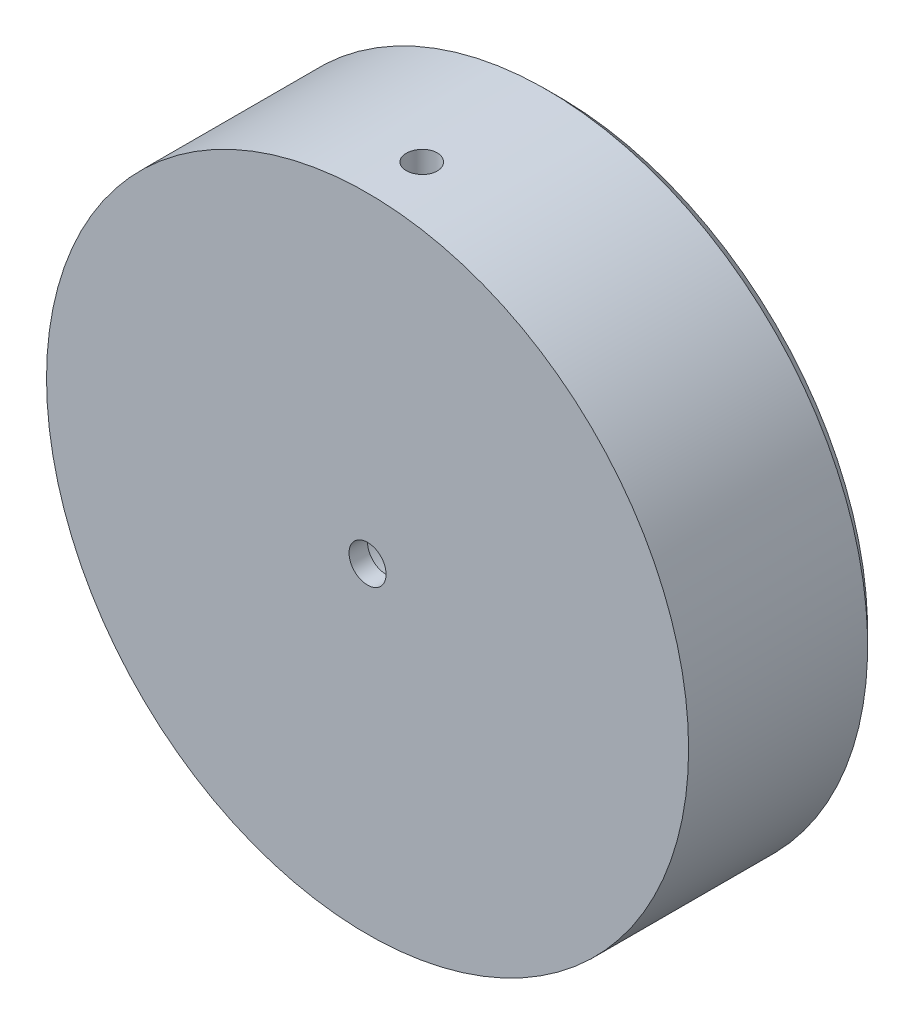
from build123d import *

# Parameters (mm, degrees)
ESBO_O1_R                  = 26
ESBO_O1_R_2                = 13.905
RESSALTO_EXTRUS_O1_DEPTH   = 11
ESBO_O2_R                  = 26
RESSALTO_EXTRUS_O2_DEPTH   = 6.5
ESBO_O3_R                  = 1.5
CORTE_EXTRUS_O1_DEPTH      = 40
ESBO_O4_R                  = 4.5
CORTE_EXTRUS_O2_DEPTH      = 5
ESBO_O6_R                  = 41
CORTE_EXTRUS_O4_DEPTH      = 2
CHANFRO1_SIZE              = 1
CORTE_EXTRUS_O5_DEPTH      = 52
CORTE_EXTRUS_O5_DEPTH_BACK = 61
ESBO_O7_R                  = 1.25


with BuildPart() as part:
    # Esboço1 → Ressalto-extrusão1 (new body)
    with BuildSketch(Plane.XY):
        Circle(ESBO_O1_R)
        Circle(ESBO_O1_R_2, mode=Mode.SUBTRACT)
    extrude(amount=RESSALTO_EXTRUS_O1_DEPTH)

    # Esboço2 → Ressalto-extrusão2 (add)
    with BuildSketch(Plane.XY.offset(11)):
        Circle(ESBO_O2_R)
    extrude(amount=RESSALTO_EXTRUS_O2_DEPTH)

    # Esboço3 → Corte-extrusão1 (cut)
    with BuildSketch(Plane.XY.offset(17.5)):
        Circle(ESBO_O3_R)
    extrude(amount=-CORTE_EXTRUS_O1_DEPTH, mode=Mode.SUBTRACT)

    # Esboço4 → Corte-extrusão2 (cut)
    with BuildSketch(Plane(origin=(0, 0, 11), x_dir=(-1, 0, 0), z_dir=(0, 0, -1))):
        Circle(ESBO_O4_R)
    extrude(amount=-CORTE_EXTRUS_O2_DEPTH, mode=Mode.SUBTRACT)

    # Esboço6 → Corte-extrusão4 (cut)
    with BuildSketch(Plane(origin=(0, 0, 0), x_dir=(-1, 0, 0), z_dir=(0, 0, -1))):
        Circle(ESBO_O6_R)
    extrude(amount=-CORTE_EXTRUS_O4_DEPTH, mode=Mode.SUBTRACT)

    # Chanfro1
    chanfro1_edges = [part.edges().sort_by_distance(p)[0] for p in [
        (-26, 0, 2),
    ]]
    chamfer(chanfro1_edges, length=CHANFRO1_SIZE)

    # Esboço7 → Corte-extrusão5 (cut, two sides: drawn at the far end of the back side and taken through both)
    with BuildSketch(Plane(origin=(0, 0, 0), x_dir=(1, 0, 0), z_dir=(0, 1, 0)).offset(-CORTE_EXTRUS_O5_DEPTH_BACK)):
        with Locations(Location((0, -13.114571218, 0), (0, 0, 90))):
            Circle(ESBO_O7_R)
    extrude(amount=CORTE_EXTRUS_O5_DEPTH + CORTE_EXTRUS_O5_DEPTH_BACK, mode=Mode.SUBTRACT)


solid = part.part
